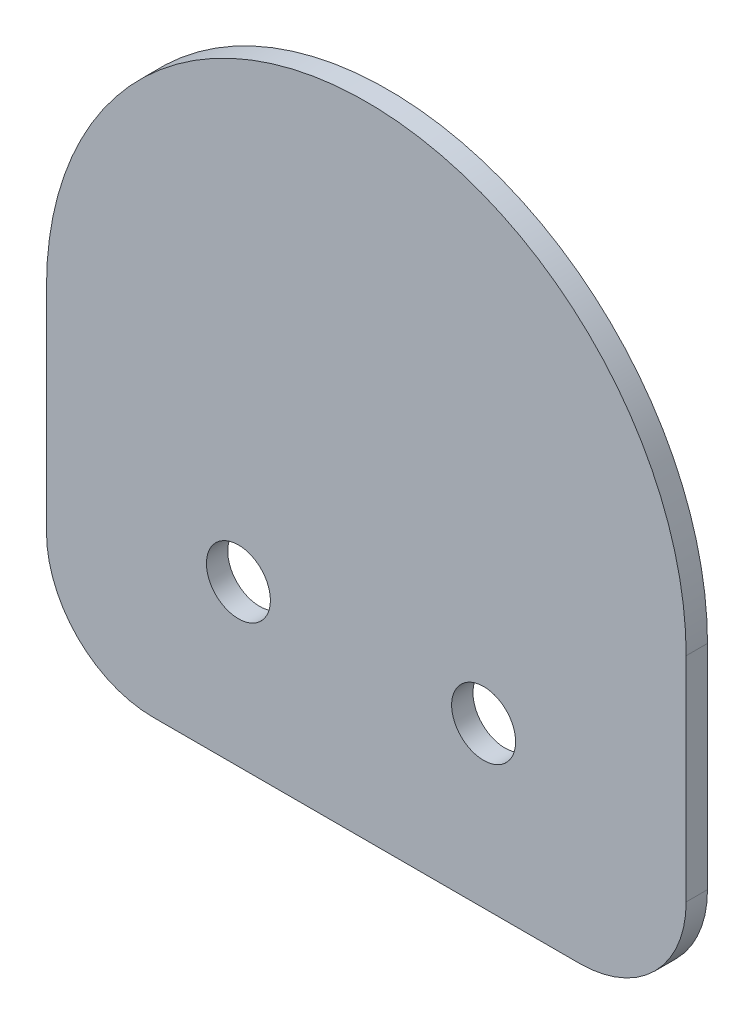
from build123d import *

# Parameters (mm, degrees)
SKETCH1_R           = 1.5
BOSS_EXTRUDE1_DEPTH = 1
FILLET2_R           = 5
FILLET3_R           = 5


with BuildPart() as part:
    # Sketch1 → Boss-Extrude1 (new body)
    with BuildSketch(Plane.XY):
        with BuildLine():
            Line((-23.772522595, 48.487733688), (6.227477405, 48.487733688))
            Line((6.227477405, 48.487733688), (6.227477405, 63.487733688))
            ThreePointArc((6.227477405, 63.487733688), (-8.772522595, 78.487733688), (-23.772522595, 63.487733688))
            Line((-23.772522595, 63.487733688), (-23.772522595, 48.487733688))
        make_face()
        with Locations((-14.772522595, 55.987733688)):
            Circle(SKETCH1_R, mode=Mode.SUBTRACT)
        with Locations((-3.272522595, 55.987733688)):
            Circle(SKETCH1_R, mode=Mode.SUBTRACT)
    extrude(amount=BOSS_EXTRUDE1_DEPTH)

    # Fillet2
    fillet2_edges = [part.edges().sort_by_distance(p)[0] for p in [
        (-23.772522595, 48.487733688, 0.5),
    ]]
    fillet(fillet2_edges, radius=FILLET2_R)

    # Fillet3
    fillet3_edges = [part.edges().sort_by_distance(p)[0] for p in [
        (6.227477405, 48.487733688, 0.5),
    ]]
    fillet(fillet3_edges, radius=FILLET3_R)


solid = part.part
